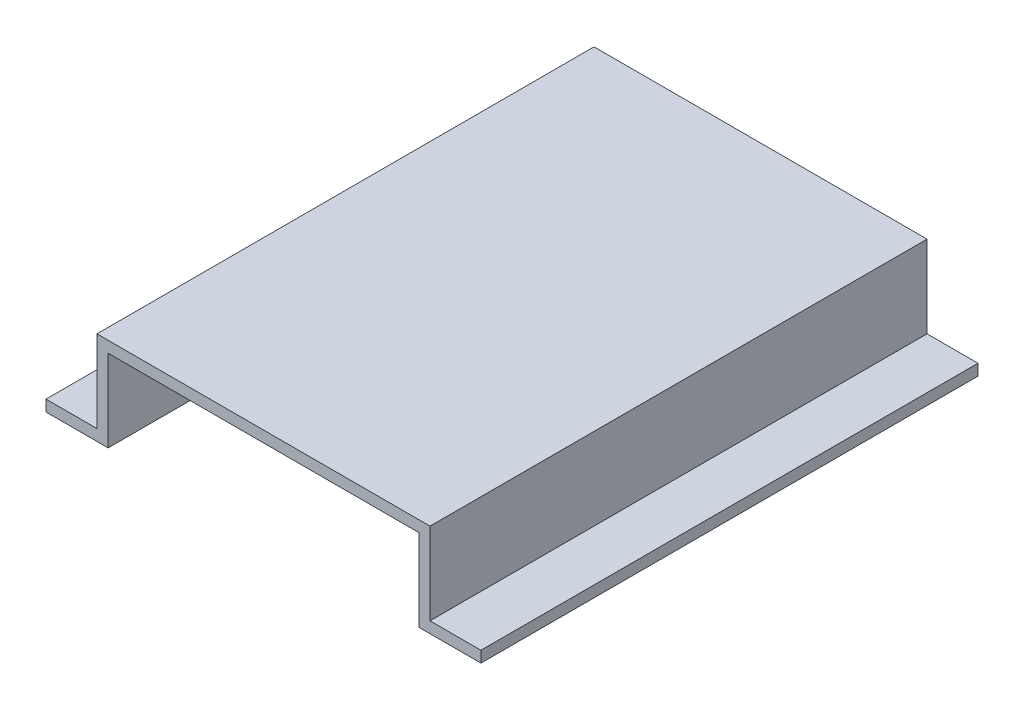
from build123d import *

# Parameters (mm, degrees)
EXTRUDE_1_DEPTH = 40


with BuildPart() as part:
    # 草图1 → 凸台-拉伸1 (new body)
    with BuildSketch(Plane.XY):
        Polygon((12.5, 0), (-12.5, 0), (-12.5, -6.6), (-17.5, -6.6), (-17.5, -5.7), (-13.4, -5.7), (-13.4, 0.9), (13.4, 0.9), (13.4, -5.7), (17.5, -5.7), (17.5, -6.6), (12.5, -6.6), align=None)
    extrude(amount=EXTRUDE_1_DEPTH)


solid = part.part
